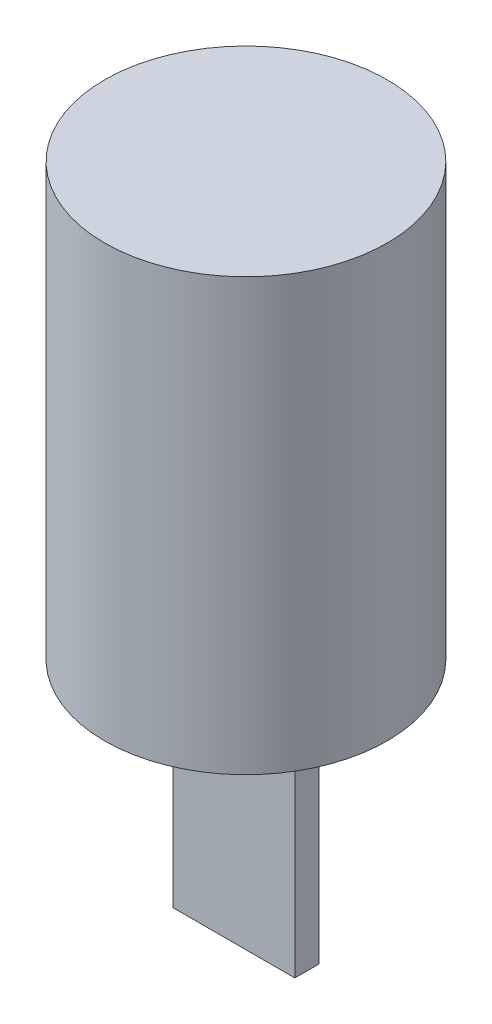
from build123d import *

# Parameters (mm, degrees)
SKETCH2_R           = 2.95
BOSS_EXTRUDE1_DEPTH = 9
SKETCH3_W           = 2.54
SKETCH3_H           = 0.5
BOSS_EXTRUDE2_DEPTH = 5


with BuildPart() as part:
    # Sketch2 → Boss-Extrude1 (new body)
    with BuildSketch(Plane(origin=(0, 0, 0), x_dir=(1, 0, 0), z_dir=(0, 1, 0))):
        with Locations(Location((0, 0, 0), (0, 0, 270))):
            Circle(SKETCH2_R)
    extrude(amount=BOSS_EXTRUDE1_DEPTH)

    # Sketch3 → Boss-Extrude2 (add)
    with BuildSketch(Plane.XZ):
        Rectangle(SKETCH3_W, SKETCH3_H)
    extrude(amount=BOSS_EXTRUDE2_DEPTH)


solid = part.part
